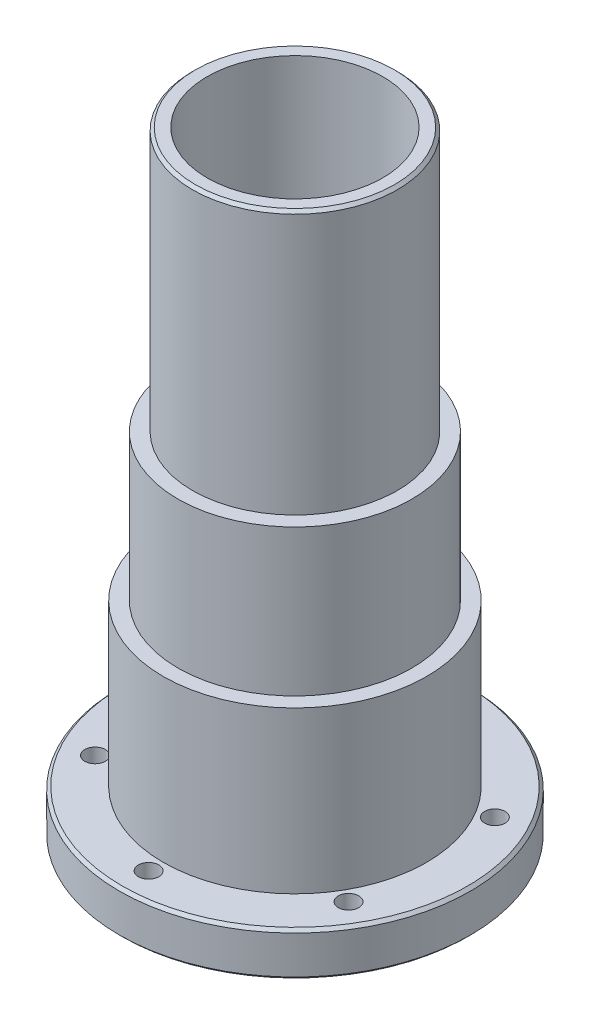
from build123d import *

# Parameters (mm, degrees)
HOLE_WIZARD_1_D           = 3.5
HOLE_WIZARD_1_CBORE_D     = 6
HOLE_WIZARD_1_CBORE_DEPTH = 4
PATTERN_CIRCULAR_1_COUNT  = 6
CHAMFER_1_SIZE            = 0.5


with BuildPart() as part:
    # 草图1 → 旋转1 (revolve)
    with BuildSketch(Plane(origin=(0, 0, 0), x_dir=(0, 0, -1), z_dir=(1, 0, 0))):
        Polygon((-15, 105), (-15, 0), (-30, 0), (-30, 7.5), (-22.5, 7.5), (-22.5, 35), (-20, 35), (-20, 60), (-17.5, 60), (-17.5, 105), align=None)
    revolve(axis=Axis((0, 44, 0), (0, -1, 0)))

    # 打孔尺寸(%根据)内六角圆柱头螺钉的类型1 (through all)
    with Locations(Plane(origin=(0, 0, 0), x_dir=(-1, 0, 0), z_dir=(0, -1, 0))):
        with Locations((0, -25)):
            hole_wizard_1 = CounterBoreHole(HOLE_WIZARD_1_D / 2, HOLE_WIZARD_1_CBORE_D / 2, HOLE_WIZARD_1_CBORE_DEPTH)

    # 阵列(圆周)1: 打孔尺寸(%根据)内六角圆柱头螺钉的类型1 ×6 about axis
    pattern_circular_1_axis = Axis((0, 0, 0), (0, 1, 0))
    for i in range(1, PATTERN_CIRCULAR_1_COUNT):
        add(hole_wizard_1.rotate(pattern_circular_1_axis, i * 360 / PATTERN_CIRCULAR_1_COUNT), mode=Mode.SUBTRACT)

    # 倒角1
    chamfer_1_edges = [part.edges().sort_by_distance(p)[0] for p in [
        (0, 7.5, -30),
        (0, 0, -30),
        (0, 105, -17.5),
    ]]
    chamfer(chamfer_1_edges, length=CHAMFER_1_SIZE)


solid = part.part
